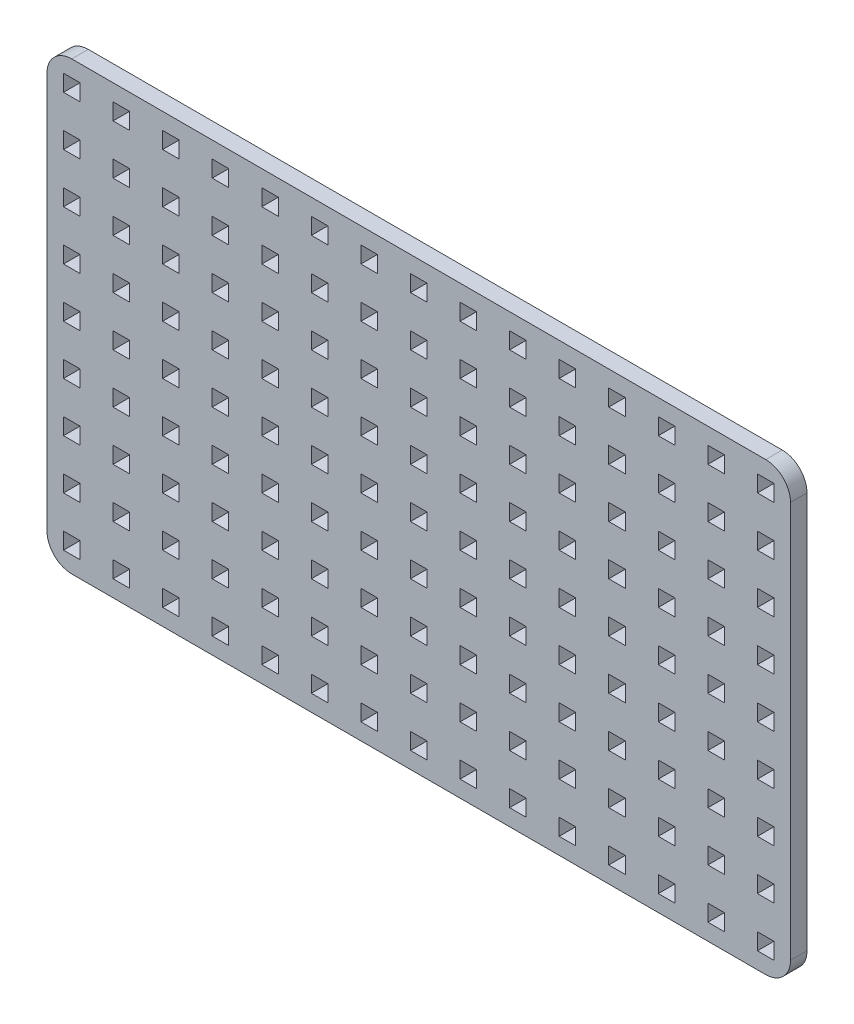
from build123d import *

# Parameters (mm, degrees)
MODEL_W                 = 3
MODEL_H                 = 3
SALIENTE_EXTRUIR1_DEPTH = 3


with BuildPart() as part:
    # Model → Saliente-Extruir1 (new body)
    with BuildSketch(Plane.XY):
        with BuildLine():
            Line((144.503562903, 219.753318122), (144.503562903, 291.750590276))
            ThreePointArc((144.503562903, 291.750590276), (143.185543418, 294.932570791), (140.003562903, 296.250590276))
            Line((140.003562903, 296.250590276), (14.003562903, 296.250590276))
            ThreePointArc((14.003562903, 296.250590276), (10.821582388, 294.932570791), (9.503562903, 291.750590276))
            Line((9.503562903, 291.750590276), (9.503562903, 219.753318122))
            ThreePointArc((9.503562903, 219.753318122), (10.821582388, 216.571337607), (14.003562903, 215.253318122))
            Line((14.003562903, 215.253318122), (140.003562903, 215.253318122))
            ThreePointArc((140.003562903, 215.253318122), (143.185543418, 216.571337607), (144.503562903, 219.753318122))
        make_face()
        with Locations((14.003562903, 291.750590276)):
            Rectangle(MODEL_W, MODEL_H, mode=Mode.SUBTRACT)
        with Locations((23.003562903, 291.750590276)):
            Rectangle(MODEL_W, MODEL_H, mode=Mode.SUBTRACT)
        with Locations((32.003562903, 291.750590276)):
            Rectangle(MODEL_W, MODEL_H, mode=Mode.SUBTRACT)
        with Locations((41.003562903, 291.750590276)):
            Rectangle(MODEL_W, MODEL_H, mode=Mode.SUBTRACT)
        with Locations((50.003562903, 291.750590276)):
            Rectangle(MODEL_W, MODEL_H, mode=Mode.SUBTRACT)
        with Locations((59.003562903, 291.750590276)):
            Rectangle(MODEL_W, MODEL_H, mode=Mode.SUBTRACT)
        with Locations((68.003562903, 291.750590276)):
            Rectangle(MODEL_W, MODEL_H, mode=Mode.SUBTRACT)
        with Locations((77.003562903, 291.750590276)):
            Rectangle(MODEL_W, MODEL_H, mode=Mode.SUBTRACT)
        with Locations((86.003562903, 291.750590276)):
            Rectangle(MODEL_W, MODEL_H, mode=Mode.SUBTRACT)
        with Locations((95.003562903, 291.750590276)):
            Rectangle(MODEL_W, MODEL_H, mode=Mode.SUBTRACT)
        with Locations((104.003562903, 291.750590276)):
            Rectangle(MODEL_W, MODEL_H, mode=Mode.SUBTRACT)
        with Locations((113.003562903, 291.750590276)):
            Rectangle(MODEL_W, MODEL_H, mode=Mode.SUBTRACT)
        with Locations((122.003562903, 291.750590276)):
            Rectangle(MODEL_W, MODEL_H, mode=Mode.SUBTRACT)
        with Locations((131.003562903, 291.750590276)):
            Rectangle(MODEL_W, MODEL_H, mode=Mode.SUBTRACT)
        with Locations((140.003562903, 291.750590276)):
            Rectangle(MODEL_W, MODEL_H, mode=Mode.SUBTRACT)
        with Locations((14.003562903, 282.750590276)):
            Rectangle(MODEL_W, MODEL_H, mode=Mode.SUBTRACT)
        with Locations((23.003562903, 282.750590276)):
            Rectangle(MODEL_W, MODEL_H, mode=Mode.SUBTRACT)
        with Locations((32.003562903, 282.750590276)):
            Rectangle(MODEL_W, MODEL_H, mode=Mode.SUBTRACT)
        with Locations((41.003562903, 282.750590276)):
            Rectangle(MODEL_W, MODEL_H, mode=Mode.SUBTRACT)
        with Locations((50.003562903, 282.750590276)):
            Rectangle(MODEL_W, MODEL_H, mode=Mode.SUBTRACT)
        with Locations((59.003562903, 282.750590276)):
            Rectangle(MODEL_W, MODEL_H, mode=Mode.SUBTRACT)
        with Locations((68.003562903, 282.750590276)):
            Rectangle(MODEL_W, MODEL_H, mode=Mode.SUBTRACT)
        with Locations((77.003562903, 282.750590276)):
            Rectangle(MODEL_W, MODEL_H, mode=Mode.SUBTRACT)
        with Locations((86.003562903, 282.750590276)):
            Rectangle(MODEL_W, MODEL_H, mode=Mode.SUBTRACT)
        with Locations((95.003562903, 282.750590276)):
            Rectangle(MODEL_W, MODEL_H, mode=Mode.SUBTRACT)
        with Locations((104.003562903, 282.750590276)):
            Rectangle(MODEL_W, MODEL_H, mode=Mode.SUBTRACT)
        with Locations((113.003562903, 282.750590276)):
            Rectangle(MODEL_W, MODEL_H, mode=Mode.SUBTRACT)
        with Locations((122.003562903, 282.750590276)):
            Rectangle(MODEL_W, MODEL_H, mode=Mode.SUBTRACT)
        with Locations((131.003562903, 282.750590276)):
            Rectangle(MODEL_W, MODEL_H, mode=Mode.SUBTRACT)
        with Locations((140.003562903, 282.750590276)):
            Rectangle(MODEL_W, MODEL_H, mode=Mode.SUBTRACT)
        with Locations((14.003562903, 273.750590276)):
            Rectangle(MODEL_W, MODEL_H, mode=Mode.SUBTRACT)
        with Locations((23.003562903, 273.750590276)):
            Rectangle(MODEL_W, MODEL_H, mode=Mode.SUBTRACT)
        with Locations((32.003562903, 273.750590276)):
            Rectangle(MODEL_W, MODEL_H, mode=Mode.SUBTRACT)
        with Locations((41.003562903, 273.750590276)):
            Rectangle(MODEL_W, MODEL_H, mode=Mode.SUBTRACT)
        with Locations((50.003562903, 273.750590276)):
            Rectangle(MODEL_W, MODEL_H, mode=Mode.SUBTRACT)
        with Locations((59.003562903, 273.750590276)):
            Rectangle(MODEL_W, MODEL_H, mode=Mode.SUBTRACT)
        with Locations((68.003562903, 273.750590276)):
            Rectangle(MODEL_W, MODEL_H, mode=Mode.SUBTRACT)
        with Locations((77.003562903, 273.750590276)):
            Rectangle(MODEL_W, MODEL_H, mode=Mode.SUBTRACT)
        with Locations((86.003562903, 273.750590276)):
            Rectangle(MODEL_W, MODEL_H, mode=Mode.SUBTRACT)
        with Locations((95.003562903, 273.750590276)):
            Rectangle(MODEL_W, MODEL_H, mode=Mode.SUBTRACT)
        with Locations((104.003562903, 273.750590276)):
            Rectangle(MODEL_W, MODEL_H, mode=Mode.SUBTRACT)
        with Locations((113.003562903, 273.750590276)):
            Rectangle(MODEL_W, MODEL_H, mode=Mode.SUBTRACT)
        with Locations((122.003562903, 273.750590276)):
            Rectangle(MODEL_W, MODEL_H, mode=Mode.SUBTRACT)
        with Locations((131.003562903, 273.750590276)):
            Rectangle(MODEL_W, MODEL_H, mode=Mode.SUBTRACT)
        with Locations((140.003562903, 273.750590276)):
            Rectangle(MODEL_W, MODEL_H, mode=Mode.SUBTRACT)
        with Locations((14.003562903, 264.750590276)):
            Rectangle(MODEL_W, MODEL_H, mode=Mode.SUBTRACT)
        with Locations((23.003562903, 264.750590276)):
            Rectangle(MODEL_W, MODEL_H, mode=Mode.SUBTRACT)
        with Locations((32.003562903, 264.750590276)):
            Rectangle(MODEL_W, MODEL_H, mode=Mode.SUBTRACT)
        with Locations((41.003562903, 264.750590276)):
            Rectangle(MODEL_W, MODEL_H, mode=Mode.SUBTRACT)
        with Locations((50.003562903, 264.750590276)):
            Rectangle(MODEL_W, MODEL_H, mode=Mode.SUBTRACT)
        with Locations((59.003562903, 264.750590276)):
            Rectangle(MODEL_W, MODEL_H, mode=Mode.SUBTRACT)
        with Locations((68.003562903, 264.750590276)):
            Rectangle(MODEL_W, MODEL_H, mode=Mode.SUBTRACT)
        with Locations((77.003562903, 264.750590276)):
            Rectangle(MODEL_W, MODEL_H, mode=Mode.SUBTRACT)
        with Locations((86.003562903, 264.750590276)):
            Rectangle(MODEL_W, MODEL_H, mode=Mode.SUBTRACT)
        with Locations((95.003562903, 264.750590276)):
            Rectangle(MODEL_W, MODEL_H, mode=Mode.SUBTRACT)
        with Locations((104.003562903, 264.750590276)):
            Rectangle(MODEL_W, MODEL_H, mode=Mode.SUBTRACT)
        with Locations((113.003562903, 264.750590276)):
            Rectangle(MODEL_W, MODEL_H, mode=Mode.SUBTRACT)
        with Locations((122.003562903, 264.750590276)):
            Rectangle(MODEL_W, MODEL_H, mode=Mode.SUBTRACT)
        with Locations((131.003562903, 264.750590276)):
            Rectangle(MODEL_W, MODEL_H, mode=Mode.SUBTRACT)
        with Locations((140.003562903, 264.750590276)):
            Rectangle(MODEL_W, MODEL_H, mode=Mode.SUBTRACT)
        with Locations((14.003562903, 255.750590276)):
            Rectangle(MODEL_W, MODEL_H, mode=Mode.SUBTRACT)
        with Locations((23.003562903, 255.750590276)):
            Rectangle(MODEL_W, MODEL_H, mode=Mode.SUBTRACT)
        with Locations((32.003562903, 255.750590276)):
            Rectangle(MODEL_W, MODEL_H, mode=Mode.SUBTRACT)
        with Locations((41.003562903, 255.750590276)):
            Rectangle(MODEL_W, MODEL_H, mode=Mode.SUBTRACT)
        with Locations((50.003562903, 255.750590276)):
            Rectangle(MODEL_W, MODEL_H, mode=Mode.SUBTRACT)
        with Locations((59.003562903, 255.750590276)):
            Rectangle(MODEL_W, MODEL_H, mode=Mode.SUBTRACT)
        with Locations((68.003562903, 255.750590276)):
            Rectangle(MODEL_W, MODEL_H, mode=Mode.SUBTRACT)
        with Locations((77.003562903, 255.750590276)):
            Rectangle(MODEL_W, MODEL_H, mode=Mode.SUBTRACT)
        with Locations((86.003562903, 255.750590276)):
            Rectangle(MODEL_W, MODEL_H, mode=Mode.SUBTRACT)
        with Locations((95.003562903, 255.750590276)):
            Rectangle(MODEL_W, MODEL_H, mode=Mode.SUBTRACT)
        with Locations((104.003562903, 255.750590276)):
            Rectangle(MODEL_W, MODEL_H, mode=Mode.SUBTRACT)
        with Locations((113.003562903, 255.750590276)):
            Rectangle(MODEL_W, MODEL_H, mode=Mode.SUBTRACT)
        with Locations((122.003562903, 255.750590276)):
            Rectangle(MODEL_W, MODEL_H, mode=Mode.SUBTRACT)
        with Locations((131.003562903, 255.750590276)):
            Rectangle(MODEL_W, MODEL_H, mode=Mode.SUBTRACT)
        with Locations((140.003562903, 255.750590276)):
            Rectangle(MODEL_W, MODEL_H, mode=Mode.SUBTRACT)
        with Locations((14.003562903, 246.750590276)):
            Rectangle(MODEL_W, MODEL_H, mode=Mode.SUBTRACT)
        with Locations((23.003562903, 246.750590276)):
            Rectangle(MODEL_W, MODEL_H, mode=Mode.SUBTRACT)
        with Locations((32.003562903, 246.750590276)):
            Rectangle(MODEL_W, MODEL_H, mode=Mode.SUBTRACT)
        with Locations((41.003562903, 246.750590276)):
            Rectangle(MODEL_W, MODEL_H, mode=Mode.SUBTRACT)
        with Locations((50.003562903, 246.750590276)):
            Rectangle(MODEL_W, MODEL_H, mode=Mode.SUBTRACT)
        with Locations((59.003562903, 246.750590276)):
            Rectangle(MODEL_W, MODEL_H, mode=Mode.SUBTRACT)
        with Locations((68.003562903, 246.750590276)):
            Rectangle(MODEL_W, MODEL_H, mode=Mode.SUBTRACT)
        with Locations((77.003562903, 246.750590276)):
            Rectangle(MODEL_W, MODEL_H, mode=Mode.SUBTRACT)
        with Locations((86.003562903, 246.750590276)):
            Rectangle(MODEL_W, MODEL_H, mode=Mode.SUBTRACT)
        with Locations((95.003562903, 246.750590276)):
            Rectangle(MODEL_W, MODEL_H, mode=Mode.SUBTRACT)
        with Locations((104.003562903, 246.750590276)):
            Rectangle(MODEL_W, MODEL_H, mode=Mode.SUBTRACT)
        with Locations((113.003562903, 246.750590276)):
            Rectangle(MODEL_W, MODEL_H, mode=Mode.SUBTRACT)
        with Locations((122.003562903, 246.750590276)):
            Rectangle(MODEL_W, MODEL_H, mode=Mode.SUBTRACT)
        with Locations((131.003562903, 246.750590276)):
            Rectangle(MODEL_W, MODEL_H, mode=Mode.SUBTRACT)
        with Locations((140.003562903, 246.750590276)):
            Rectangle(MODEL_W, MODEL_H, mode=Mode.SUBTRACT)
        with Locations((14.003562903, 237.750590276)):
            Rectangle(MODEL_W, MODEL_H, mode=Mode.SUBTRACT)
        with Locations((23.003562903, 237.750590276)):
            Rectangle(MODEL_W, MODEL_H, mode=Mode.SUBTRACT)
        with Locations((32.003562903, 237.750590276)):
            Rectangle(MODEL_W, MODEL_H, mode=Mode.SUBTRACT)
        with Locations((41.003562903, 237.750590276)):
            Rectangle(MODEL_W, MODEL_H, mode=Mode.SUBTRACT)
        with Locations((50.003562903, 237.750590276)):
            Rectangle(MODEL_W, MODEL_H, mode=Mode.SUBTRACT)
        with Locations((59.003562903, 237.750590276)):
            Rectangle(MODEL_W, MODEL_H, mode=Mode.SUBTRACT)
        with Locations((68.003562903, 237.750590276)):
            Rectangle(MODEL_W, MODEL_H, mode=Mode.SUBTRACT)
        with Locations((77.003562903, 237.750590276)):
            Rectangle(MODEL_W, MODEL_H, mode=Mode.SUBTRACT)
        with Locations((86.003562903, 237.750590276)):
            Rectangle(MODEL_W, MODEL_H, mode=Mode.SUBTRACT)
        with Locations((95.003562903, 237.750590276)):
            Rectangle(MODEL_W, MODEL_H, mode=Mode.SUBTRACT)
        with Locations((104.003562903, 237.750590276)):
            Rectangle(MODEL_W, MODEL_H, mode=Mode.SUBTRACT)
        with Locations((113.003562903, 237.750590276)):
            Rectangle(MODEL_W, MODEL_H, mode=Mode.SUBTRACT)
        with Locations((122.003562903, 237.750590276)):
            Rectangle(MODEL_W, MODEL_H, mode=Mode.SUBTRACT)
        with Locations((131.003562903, 237.750590276)):
            Rectangle(MODEL_W, MODEL_H, mode=Mode.SUBTRACT)
        with Locations((140.003562903, 237.750590276)):
            Rectangle(MODEL_W, MODEL_H, mode=Mode.SUBTRACT)
        with Locations((14.003562903, 228.750590276)):
            Rectangle(MODEL_W, MODEL_H, mode=Mode.SUBTRACT)
        with Locations((23.003562903, 228.750590276)):
            Rectangle(MODEL_W, MODEL_H, mode=Mode.SUBTRACT)
        with Locations((32.003562903, 228.750590276)):
            Rectangle(MODEL_W, MODEL_H, mode=Mode.SUBTRACT)
        with Locations((41.003562903, 228.750590276)):
            Rectangle(MODEL_W, MODEL_H, mode=Mode.SUBTRACT)
        with Locations((50.003562903, 228.750590276)):
            Rectangle(MODEL_W, MODEL_H, mode=Mode.SUBTRACT)
        with Locations((59.003562903, 228.750590276)):
            Rectangle(MODEL_W, MODEL_H, mode=Mode.SUBTRACT)
        with Locations((68.003562903, 228.750590276)):
            Rectangle(MODEL_W, MODEL_H, mode=Mode.SUBTRACT)
        with Locations((77.003562903, 228.750590276)):
            Rectangle(MODEL_W, MODEL_H, mode=Mode.SUBTRACT)
        with Locations((86.003562903, 228.750590276)):
            Rectangle(MODEL_W, MODEL_H, mode=Mode.SUBTRACT)
        with Locations((95.003562903, 228.750590276)):
            Rectangle(MODEL_W, MODEL_H, mode=Mode.SUBTRACT)
        with Locations((104.003562903, 228.750590276)):
            Rectangle(MODEL_W, MODEL_H, mode=Mode.SUBTRACT)
        with Locations((113.003562903, 228.750590276)):
            Rectangle(MODEL_W, MODEL_H, mode=Mode.SUBTRACT)
        with Locations((122.003562903, 228.750590276)):
            Rectangle(MODEL_W, MODEL_H, mode=Mode.SUBTRACT)
        with Locations((131.003562903, 228.750590276)):
            Rectangle(MODEL_W, MODEL_H, mode=Mode.SUBTRACT)
        with Locations((140.003562903, 228.750590276)):
            Rectangle(MODEL_W, MODEL_H, mode=Mode.SUBTRACT)
        with Locations((14.003562903, 219.750590276)):
            Rectangle(MODEL_W, MODEL_H, mode=Mode.SUBTRACT)
        with Locations((23.003562903, 219.750590276)):
            Rectangle(MODEL_W, MODEL_H, mode=Mode.SUBTRACT)
        with Locations((32.003562903, 219.750590276)):
            Rectangle(MODEL_W, MODEL_H, mode=Mode.SUBTRACT)
        with Locations((41.003562903, 219.750590276)):
            Rectangle(MODEL_W, MODEL_H, mode=Mode.SUBTRACT)
        with Locations((50.003562903, 219.750590276)):
            Rectangle(MODEL_W, MODEL_H, mode=Mode.SUBTRACT)
        with Locations((59.003562903, 219.750590276)):
            Rectangle(MODEL_W, MODEL_H, mode=Mode.SUBTRACT)
        with Locations((68.003562903, 219.750590276)):
            Rectangle(MODEL_W, MODEL_H, mode=Mode.SUBTRACT)
        with Locations((77.003562903, 219.750590276)):
            Rectangle(MODEL_W, MODEL_H, mode=Mode.SUBTRACT)
        with Locations((86.003562903, 219.750590276)):
            Rectangle(MODEL_W, MODEL_H, mode=Mode.SUBTRACT)
        with Locations((95.003562903, 219.750590276)):
            Rectangle(MODEL_W, MODEL_H, mode=Mode.SUBTRACT)
        with Locations((104.003562903, 219.750590276)):
            Rectangle(MODEL_W, MODEL_H, mode=Mode.SUBTRACT)
        with Locations((113.003562903, 219.750590276)):
            Rectangle(MODEL_W, MODEL_H, mode=Mode.SUBTRACT)
        with Locations((122.003562903, 219.750590276)):
            Rectangle(MODEL_W, MODEL_H, mode=Mode.SUBTRACT)
        with Locations((131.003562903, 219.750590276)):
            Rectangle(MODEL_W, MODEL_H, mode=Mode.SUBTRACT)
        with Locations((140.003562903, 219.750590276)):
            Rectangle(MODEL_W, MODEL_H, mode=Mode.SUBTRACT)
    extrude(amount=SALIENTE_EXTRUIR1_DEPTH)


solid = part.part
